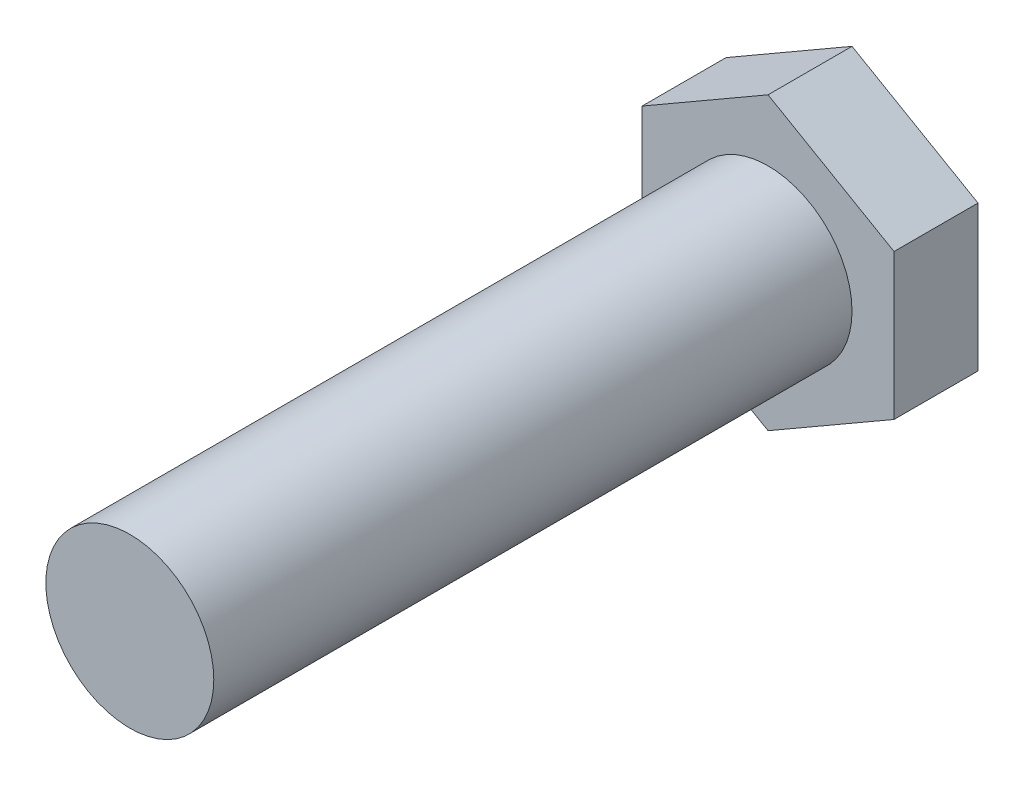
from build123d import *

# Parameters (mm, degrees)
BOSS_EXTRUDE1_DEPTH = 5
SKETCH2_R           = 5
BOSS_EXTRUDE2_DEPTH = 38


with BuildPart() as part:
    # Sketch1 → Boss-Extrude1 (new body)
    with BuildSketch(Plane.XY):
        Polygon((0, 8.660254038), (-7.5, 4.330127019), (-7.5, -4.330127019), (0, -8.660254038), (7.5, -4.330127019), (7.5, 4.330127019), align=None)
    extrude(amount=BOSS_EXTRUDE1_DEPTH)

    # Sketch2 → Boss-Extrude2 (add)
    with BuildSketch(Plane.XY.offset(5)):
        Circle(SKETCH2_R)
    extrude(amount=BOSS_EXTRUDE2_DEPTH)


solid = part.part
